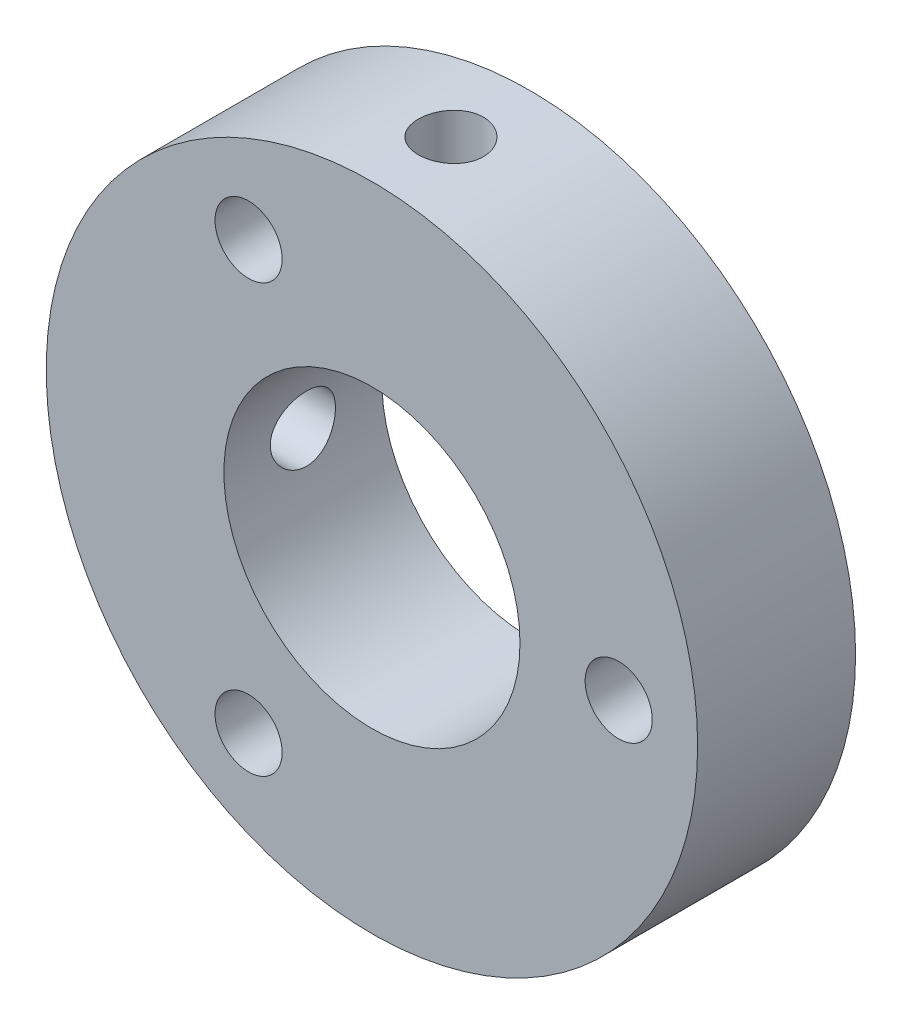
from build123d import *

# Parameters (mm, degrees)
SKETCH_1_R        = 16.5
SKETCH_1_R_2      = 7.5
EXTRUDE_1_DEPTH   = 8
HOLE_WIZARD_M31_D = 3.4
M4X0_71_REACH     = 39.752
M4X0_71_BORE_R    = 1.65
M4X0_72_REACH     = 39.752
M4X0_72_BORE_R    = 1.65


with BuildPart() as part:
    # Эскиз1 → Бобышка-Вытянуть1 (new body)
    with BuildSketch(Plane.XY):
        Circle(SKETCH_1_R)
        Circle(SKETCH_1_R_2, mode=Mode.SUBTRACT)
    extrude(amount=EXTRUDE_1_DEPTH)

    # Отверстие с зазором M31 (through all)
    with Locations(Plane.XY.offset(8)):
        with Locations((-6.25, 10.825317547), (12.5, 0), (-6.25, -10.825317547)):
            Hole(HOLE_WIZARD_M31_D / 2)

    # Отверстие обработанное метчиком M4x0.71 bore → Отверстие обработанное метчиком M4x0.71 (cut, up to next)
    with BuildSketch(Plane.ZY.offset(16.5), mode=Mode.PRIVATE) as m4x0_71_sk1:
        with Locations((4, 0)):
            Circle(M4X0_71_BORE_R)
    m4x0_71_tool1 = extrude(m4x0_71_sk1.sketch, amount=-M4X0_71_REACH, mode=Mode.PRIVATE) & part.part
    add(m4x0_71_tool1.solids().sort_by_distance((-16.5, 0, 4))[0], mode=Mode.SUBTRACT)

    # Отверстие обработанное метчиком M4x0.72 bore → Отверстие обработанное метчиком M4x0.72 (cut, up to next)
    with BuildSketch(Plane.ZX.offset(16.5), mode=Mode.PRIVATE) as m4x0_72_sk1:
        with Locations((4, 0)):
            Circle(M4X0_72_BORE_R)
    m4x0_72_tool1 = extrude(m4x0_72_sk1.sketch, amount=-M4X0_72_REACH, mode=Mode.PRIVATE) & part.part
    add(m4x0_72_tool1.solids().sort_by_distance((0, 16.5, 4))[0], mode=Mode.SUBTRACT)


solid = part.part
